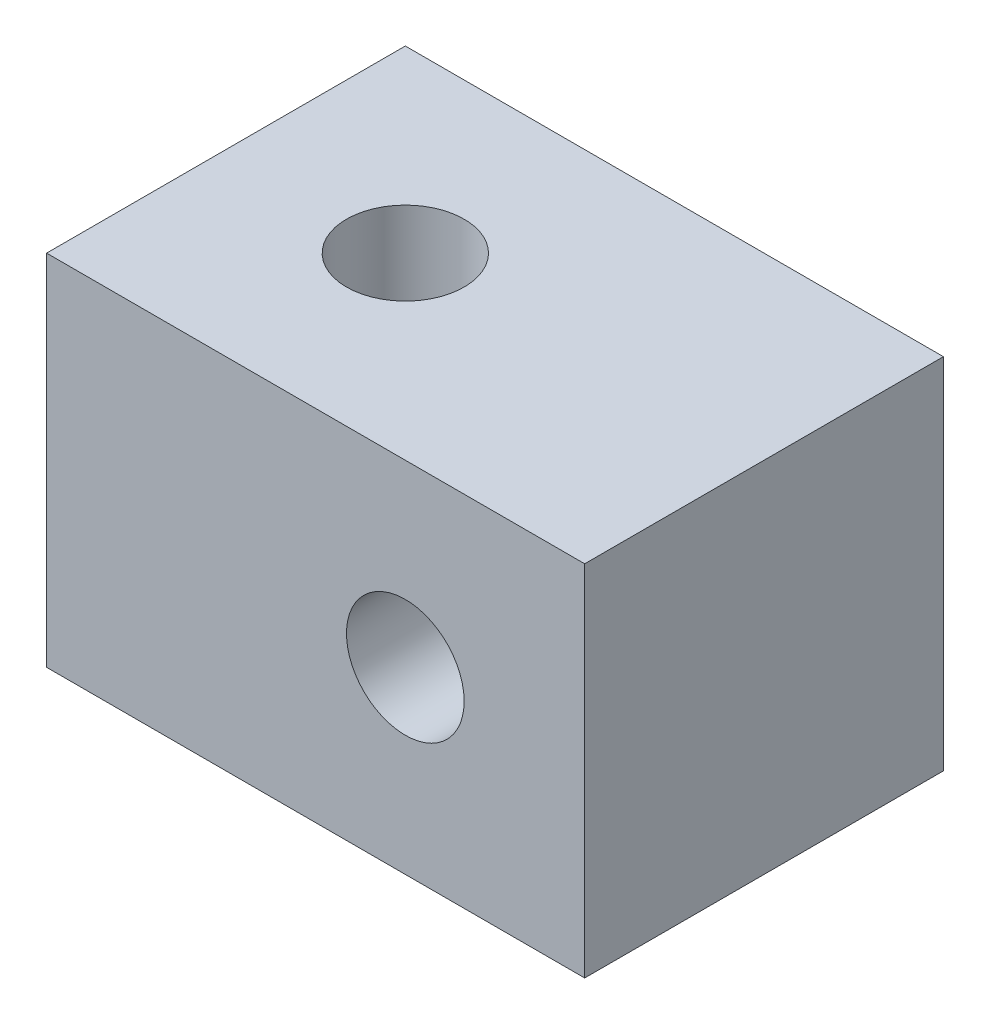
from build123d import *

# Parameters (mm, degrees)
SKETCH1_W           = 19.05
SKETCH1_H           = 12.7
SKETCH1_R           = 2.0828
BOSS_EXTRUDE1_DEPTH = 12.7
SKETCH2_R           = 2.0828
CUT_EXTRUDE1_DEPTH  = 12.7


with BuildPart() as part:
    # Sketch1 → Boss-Extrude1 (new body)
    with BuildSketch(Plane(origin=(0, 0, 0), x_dir=(1, 0, 0), z_dir=(0, 1, 0))):
        with Locations((9.525, 6.35)):
            Rectangle(SKETCH1_W, SKETCH1_H)
        with Locations(Location((6.35, 6.35, 0), (0, 0, 270))):
            Circle(SKETCH1_R, mode=Mode.SUBTRACT)
    extrude(amount=BOSS_EXTRUDE1_DEPTH)

    # Sketch2 → Cut-Extrude1 (cut)
    with BuildSketch(Plane.XY):
        with Locations((12.7, 6.35)):
            Circle(SKETCH2_R)
    extrude(amount=-CUT_EXTRUDE1_DEPTH, mode=Mode.SUBTRACT)


solid = part.part
